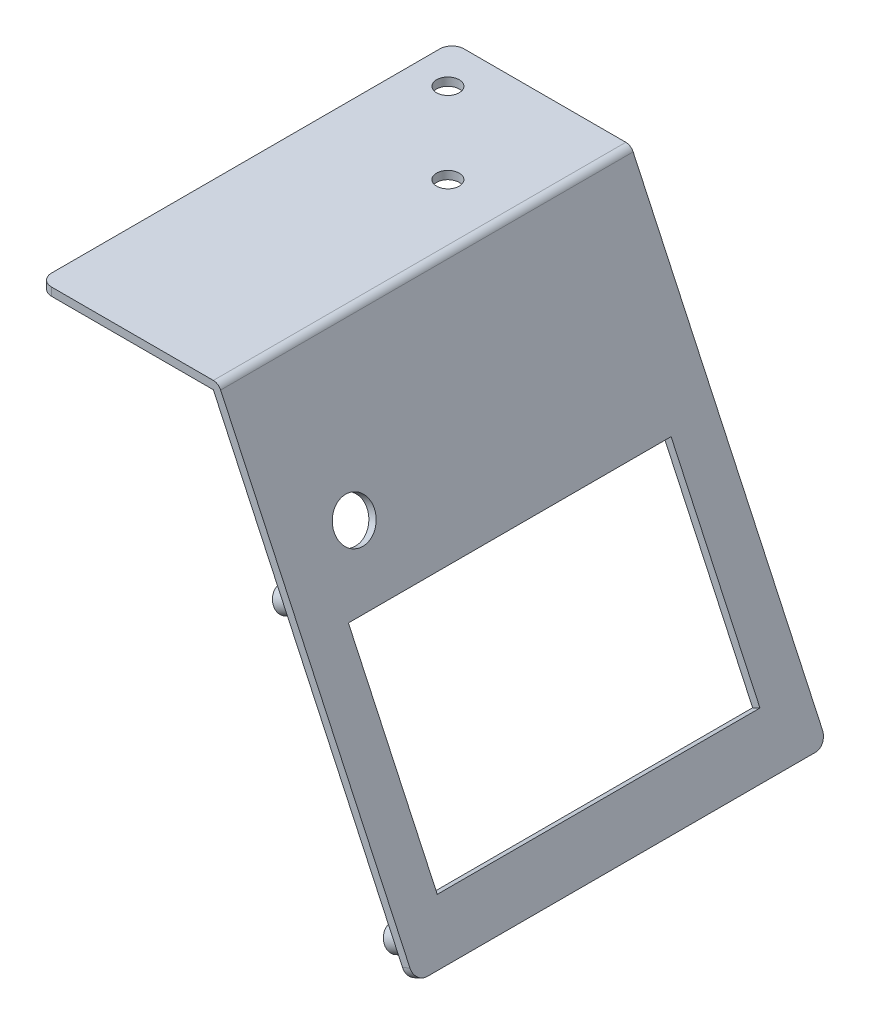
from build123d import *

# Parameters (mm, degrees)
BOSS_EXTRUDE1_DEPTH            = 102
SKETCH2_W                      = 79.8
SKETCH2_H                      = 52
CUT_EXTRUDE1_DEPTH             = 169.784535141
F_10_0_10_DIAMETER_HOLE1_D     = 10
F_10_0_10_DIAMETER_HOLE1_DEPTH = 46.047555479
F_5_6_5_6_DIAMETER_HOLE1_D     = 5.6
F_2_7_2_7_DIAMETER_HOLE1_D     = 2.7
F_2_7_2_7_DIAMETER_HOLE1_DEPTH = 7
FILLET1_R                      = 2
FILLET2_R                      = 3


with BuildPart() as part:
    # Sketch1 → Boss-Extrude1 (new body)
    with BuildSketch(Plane(origin=(0, 0, 0), x_dir=(-1, 0, 0), z_dir=(0, 0, -1))):
        Polygon((-91.062625048, -105.070632033), (-43, -2), (0, -2), (0, 0), (-44.274140522, 0), (-92.875240622, -104.225395509), align=None)
    extrude(amount=-BOSS_EXTRUDE1_DEPTH)

    # Sketch2 → Cut-Extrude1 (cut, through all)
    with BuildSketch(Plane(origin=(36.366504739, 16.95797966, 0), x_dir=(0, 0, -1), z_dir=(0.9063077870366478, 0.4226182617407038, 0))):
        with Locations((-51.4, -95.405591591)):
            Rectangle(SKETCH2_W, SKETCH2_H)
    extrude(amount=-CUT_EXTRUDE1_DEPTH, mode=Mode.SUBTRACT)

    # Sketch3 → Revolve1 (revolve)
    with BuildSketch(Plane(origin=(0, 0, 95.95), x_dir=(-1, 0, 0), z_dir=(0, 0, -1)), mode=Mode.PRIVATE) as revolve1_sk:
        Polygon((-56.083772126, -46.621650953), (-54.815917341, -43.902727592), (-61.16007185, -40.94439976), (-62.427926635, -43.663323121), align=None)
    revolve(revolve1_sk.sketch.rotate(Axis((53.774509275, -44.388344148, 95.95), (0.906307787036648, 0.4226182617407037, 0)), 180), axis=Axis((53.774509275, -44.388344148, 95.95), (0.906307787036648, 0.4226182617407037, 0)))

    # Sketch4 → Revolve2 (revolve)
    with BuildSketch(Plane(origin=(0, 0, 95.95), x_dir=(-1, 0, 0), z_dir=(0, 0, -1)), mode=Mode.PRIVATE) as revolve2_sk:
        Polygon((-83.511697313, -105.441026332), (-82.243842528, -102.722102971), (-88.587997037, -99.763775138), (-89.855851822, -102.482698499), align=None)
    revolve(revolve2_sk.sketch.rotate(Axis((81.202434462, -103.207719527, 95.95), (0.9063077870366476, 0.4226182617407046, 0)), 180), axis=Axis((81.202434462, -103.207719527, 95.95), (0.9063077870366476, 0.4226182617407046, 0)))

    # Sketch5 → Revolve3 (revolve)
    with BuildSketch(Plane(origin=(0, 0, 8.05), x_dir=(-1, 0, 0), z_dir=(0, 0, -1)), mode=Mode.PRIVATE) as revolve3_sk:
        Polygon((-83.511697313, -105.441026332), (-82.243842528, -102.722102971), (-88.587997037, -99.763775138), (-89.855851822, -102.482698499), align=None)
    revolve(revolve3_sk.sketch.rotate(Axis((81.202434462, -103.207719527, 8.05), (0.9063077870366479, 0.422618261740704, 0)), 180), axis=Axis((81.202434462, -103.207719527, 8.05), (0.9063077870366479, 0.422618261740704, 0)))

    # Sketch6 → Revolve4 (revolve)
    with BuildSketch(Plane(origin=(0, 0, 8.05), x_dir=(-1, 0, 0), z_dir=(0, 0, -1)), mode=Mode.PRIVATE) as revolve4_sk:
        Polygon((-56.083772126, -46.621650953), (-54.815917341, -43.902727592), (-61.16007185, -40.94439976), (-62.427926635, -43.663323121), align=None)
    revolve(revolve4_sk.sketch.rotate(Axis((53.774509275, -44.388344148, 8.05), (0.906307787036648, 0.42261826174070366, 0)), 180), axis=Axis((53.774509275, -44.388344148, 8.05), (0.906307787036648, 0.42261826174070366, 0)))

    # Ø10.0 (10) Diameter Hole1
    with Locations(Plane(origin=(34.553889165, 16.112743137, 0), x_dir=(0, 0, 1), z_dir=(-0.9063077870366479, -0.4226182617407037, 0))):
        with Locations((83.1, -53.405591591)):
            Hole(F_10_0_10_DIAMETER_HOLE1_D / 2, depth=F_10_0_10_DIAMETER_HOLE1_DEPTH)

    # Ø5.6 (5.6) Diameter Hole1 (through all)
    with Locations(Plane(origin=(0, -2, 0), x_dir=(-1, 0, 0), z_dir=(0, -1, 0))):
        with Locations((-29, -30), (-9, -10)):
            Hole(F_5_6_5_6_DIAMETER_HOLE1_D / 2)

    # Ø2.7 (2.7) Diameter Hole1
    with Locations(Plane(origin=(28.209734656, 13.154415305, 0), x_dir=(0, 0, 1), z_dir=(-0.9063077870366479, -0.4226182617407037, 0))):
        with Locations((8.05, -62.955591591), (8.05, -127.855591591), (95.95, -127.855591591), (95.95, -62.955591591)):
            Hole(F_2_7_2_7_DIAMETER_HOLE1_D / 2, depth=F_2_7_2_7_DIAMETER_HOLE1_DEPTH)

    # Fillet1
    fillet1_edges = [part.edges().sort_by_distance(p)[0] for p in [
        (44.274140522, 0, 51),
    ]]
    fillet(fillet1_edges, radius=FILLET1_R)

    # Fillet2
    fillet2_edges = [part.edges().sort_by_distance(p)[0] for p in [
        (0, -1, 102),
        (91.968932835, -104.648013771, 102),
        (0, -1, 0),
        (91.968932835, -104.648013771, 0),
    ]]
    fillet(fillet2_edges, radius=FILLET2_R)


solid = part.part
